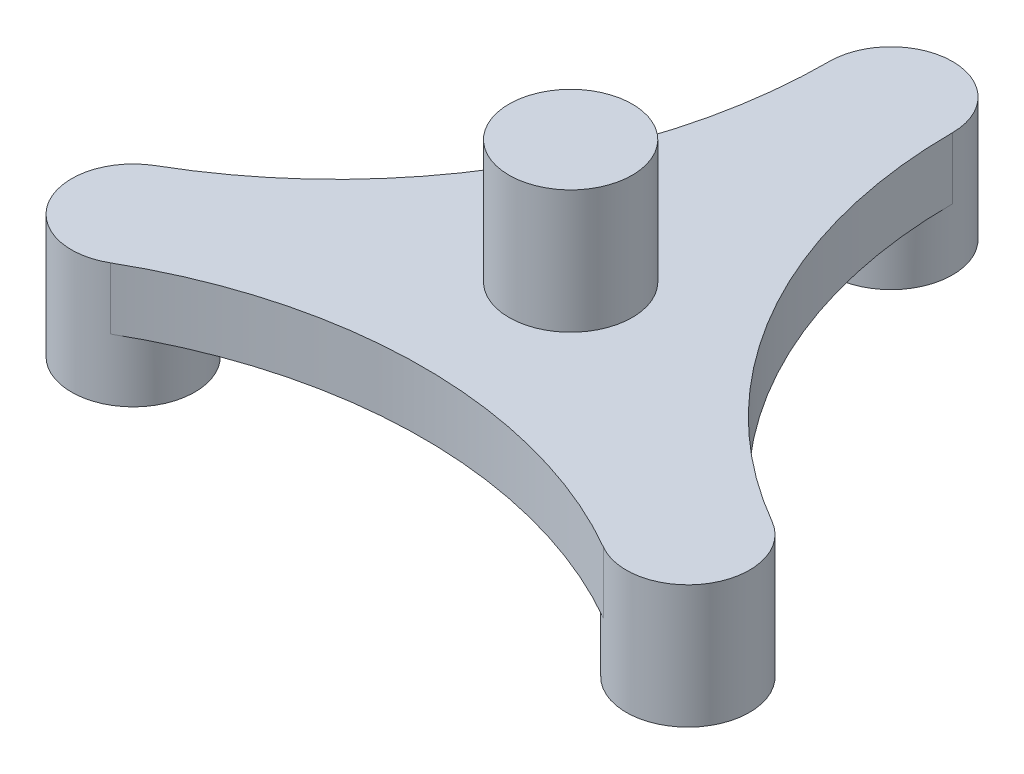
from build123d import *

# Parameters (mm, degrees)
BOSS_EXTRUDE1_DEPTH = 12.7
SKETCH2_R           = 12.7
BOSS_EXTRUDE2_DEPTH = 25.4
BOSS_EXTRUDE3_START = 12.7
SKETCH3_R           = 12.7
BOSS_EXTRUDE3_DEPTH = 12.7


with BuildPart() as part:
    # Sketch1 → Boss-Extrude1 (new body)
    with BuildSketch(Plane(origin=(0, 0, 0), x_dir=(1, 0, 0), z_dir=(0, 1, 0))):
        with BuildLine():
            ThreePointArc((-50.8, -43.994090512), (-68.148522628, -39.345567884), (-63.5, -21.997045256))
            ThreePointArc((-63.5, -21.997045256), (-26.311818976, 15.191135768), (-12.7, 65.991135768))
            ThreePointArc((-12.7, 65.991135768), (0, 78.691135768), (12.7, 65.991135768))
            ThreePointArc((12.7, 65.991135768), (26.311818976, 15.191135768), (63.5, -21.997045256))
            ThreePointArc((63.5, -21.997045256), (68.148522628, -39.345567884), (50.8, -43.994090512))
            ThreePointArc((50.8, -43.994090512), (0, -30.382271537), (-50.8, -43.994090512))
        make_face()
    extrude(amount=BOSS_EXTRUDE1_DEPTH)

    # Sketch2 → Boss-Extrude2 (add)
    with BuildSketch(Plane(origin=(0, 12.7, 0), x_dir=(1, 0, 0), z_dir=(0, 1, 0))):
        with Locations(Location((0, 0, 0), (0, 0, 270))):
            Circle(SKETCH2_R)
    extrude(amount=BOSS_EXTRUDE2_DEPTH)

    # Sketch3 → Boss-Extrude3 (add)
    with BuildSketch(Plane.XZ.offset(BOSS_EXTRUDE3_START)):
        with Locations(Location((-57.15, 32.995567884, 0), (0, 0, 270))):
            Circle(SKETCH3_R)
        with Locations(Location((57.15, 32.995567884, 0), (0, 0, 270))):
            Circle(SKETCH3_R)
        with Locations(Location((0, -65.991135768, 0), (0, 0, 270))):
            Circle(SKETCH3_R)
    extrude(amount=-BOSS_EXTRUDE3_DEPTH)


solid = part.part
